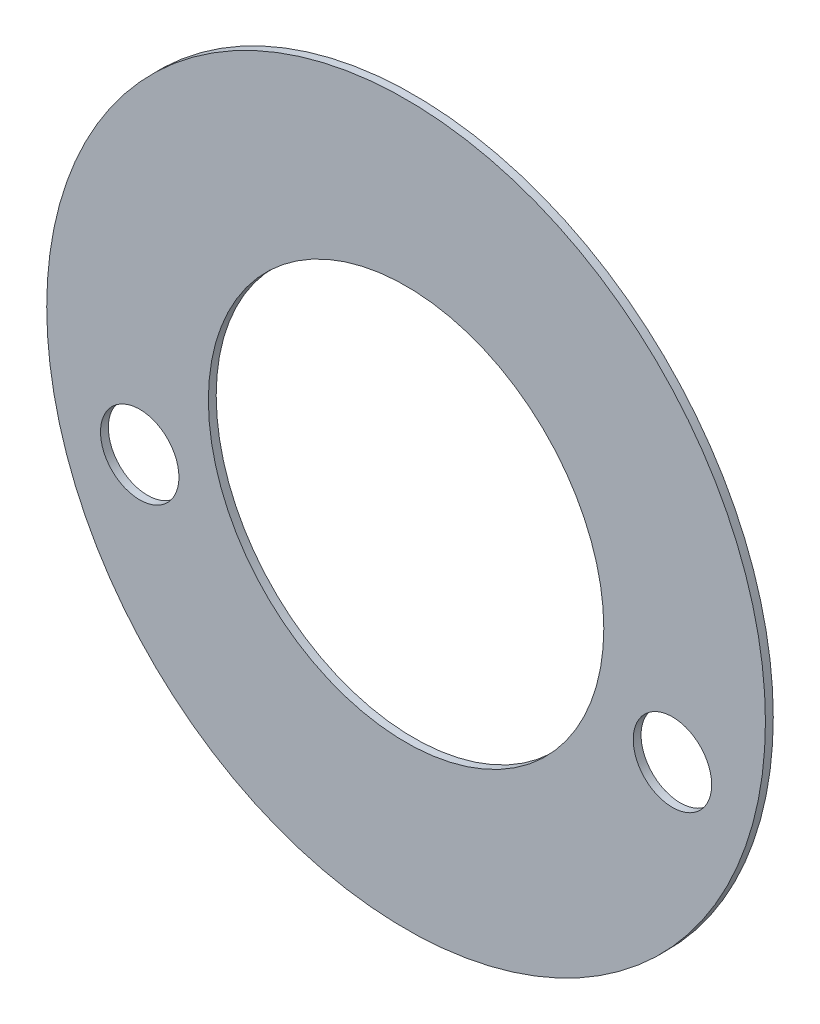
from build123d import *

# Parameters (mm, degrees)
IZIM1_R                     = 22.9
IZIM1_R_2                   = 12.6
IZIM1_R_3                   = 2.5
Y_KSEKLIK_EKSTR_ZYON1_DEPTH = 0.5


with BuildPart() as part:
    # Çizim1 → Yükseklik-Ekstrüzyon1 (new body)
    with BuildSketch(Plane.XY):
        Circle(IZIM1_R)
        Circle(IZIM1_R_2, mode=Mode.SUBTRACT)
        with Locations((-16.973503404, -5.192560273)):
            Circle(IZIM1_R_3, mode=Mode.SUBTRACT)
        with Locations((16.973503404, -5.192560273)):
            Circle(IZIM1_R_3, mode=Mode.SUBTRACT)
    extrude(amount=Y_KSEKLIK_EKSTR_ZYON1_DEPTH)


solid = part.part
